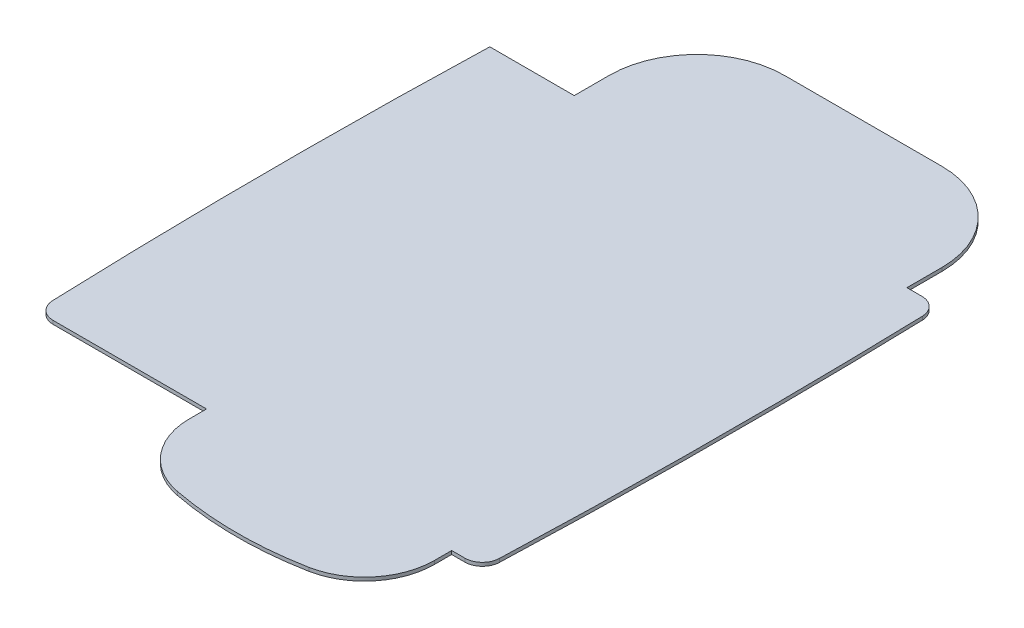
from build123d import *

# Parameters (mm, degrees)
EXTRUDE_1_DEPTH     = 0.5
SKETCH_3_W          = 25
SKETCH_3_H          = 35
CUT_EXTRUDE_1_DEPTH = 114.058613257
SKETCH_4_W          = 10
SKETCH_4_H          = 35
CUT_EXTRUDE_2_DEPTH = 114.058613257
SKETCH_5_W          = 50
SKETCH_5_H          = 20
CUT_EXTRUDE_3_DEPTH = 114.058613257
SKETCH_6_W          = 10
SKETCH_6_H          = 20
CUT_EXTRUDE_4_DEPTH = 114.058613257
EXTRUDE_2_DEPTH     = 0.5
CUT_EXTRUDE_5_DEPTH = 119.289418767
FILLET_1_R          = 5
FILLET_2_R          = 20


with BuildPart() as part:
    # ｽｹｯﾁ1 → ﾎﾞｽ - 押し出し1 (new, symmetric)
    with BuildSketch(Plane(origin=(0, 0, 0), x_dir=(1, 0, 0), z_dir=(0, 1, 0))):
        with BuildLine():
            Line((62.68888804, 92.5), (-62.68888804, 92.5))
            add(Edge.make_bspline(
                [(-62.68888804, 92.5), (-67.396314277, 0), (-62.68888804, -92.5)],
                knots=[4.444925752, 4.444925752, 4.444925752, 4.979852209, 4.979852209, 4.979852209], degree=2, weights=[1, 0.964444431, 1]))
            Line((-62.68888804, -92.5), (62.68888804, -92.5))
            add(Edge.make_bspline(
                [(62.68888804, -92.5), (67.396314277, 0), (62.68888804, 92.5)],
                knots=[1.303333099, 1.303333099, 1.303333099, 1.838259555, 1.838259555, 1.838259555], degree=2, weights=[1, 0.964444431, 1]))
        make_face()
    extrude(amount=EXTRUDE_1_DEPTH, both=True)

    # ｽｹｯﾁ3 → ｶｯﾄ - 押し出し1 (cut, through all)
    with BuildSketch(Plane(origin=(0, 0.5, 0), x_dir=(1, 0, 0), z_dir=(0, 1, 0))):
        with Locations((-52.5, 75)):
            Rectangle(SKETCH_3_W, SKETCH_3_H)
    extrude(amount=-CUT_EXTRUDE_1_DEPTH, mode=Mode.SUBTRACT)

    # ｽｹｯﾁ4 → ｶｯﾄ - 押し出し2 (cut, through all)
    with BuildSketch(Plane(origin=(0, 0.5, 0), x_dir=(1, 0, 0), z_dir=(0, 1, 0))):
        with Locations((60, 75)):
            Rectangle(SKETCH_4_W, SKETCH_4_H)
    extrude(amount=-CUT_EXTRUDE_2_DEPTH, mode=Mode.SUBTRACT)

    # ｽｹｯﾁ5 → ｶｯﾄ - 押し出し3 (cut, through all)
    with BuildSketch(Plane(origin=(0, 0.5, 0), x_dir=(1, 0, 0), z_dir=(0, 1, 0))):
        with Locations((-40, -82.5)):
            Rectangle(SKETCH_5_W, SKETCH_5_H)
    extrude(amount=-CUT_EXTRUDE_3_DEPTH, mode=Mode.SUBTRACT)

    # ｽｹｯﾁ6 → ｶｯﾄ - 押し出し4 (cut, through all)
    with BuildSketch(Plane(origin=(0, 0.5, 0), x_dir=(1, 0, 0), z_dir=(0, 1, 0))):
        with Locations((60, -82.5)):
            Rectangle(SKETCH_6_W, SKETCH_6_H)
    extrude(amount=-CUT_EXTRUDE_4_DEPTH, mode=Mode.SUBTRACT)

    # ｽｹｯﾁ7 → ﾎﾞｽ - 押し出し2 (add, symmetric)
    with BuildSketch(Plane(origin=(0, 0, 0), x_dir=(1, 0, 0), z_dir=(0, 1, 0))):
        with BuildLine():
            Line((-15, -92.5), (55, -92.5))
            ThreePointArc((55, -92.5), (20, -98.825030024), (-15, -92.5))
        make_face()
    extrude(amount=EXTRUDE_2_DEPTH, both=True)

    # ｽｹｯﾁ8 → ｶｯﾄ - 押し出し5 (cut, through all)
    with BuildSketch(Plane(origin=(0, 0.5, 0), x_dir=(1, 0, 0), z_dir=(0, 1, 0))):
        with BuildLine():
            ThreePointArc((-40, 67.5), (-32.677669545, 85.177669514), (-15.000000044, 92.5))
            Line((-15.000000044, 92.5), (-40, 92.5))
            Line((-40, 92.5), (-40, 67.5))
        make_face()
        with BuildLine():
            Line((55, 67.5), (55, 92.5))
            Line((55, 92.5), (30, 92.5))
            ThreePointArc((30, 92.5), (47.67766953, 85.17766953), (55, 67.5))
        make_face()
    extrude(amount=-CUT_EXTRUDE_5_DEPTH, mode=Mode.SUBTRACT)

    # ﾌｨﾚｯﾄ1
    fillet_1_edges = [part.edges().sort_by_distance(p)[0] for p in [
        (-63.590195865, -0.25, 72.5),
        (63.590195865, -0.2499997, 72.5),
        (64.116831739, -0.25, -57.5),
    ]]
    fillet(fillet_1_edges, radius=FILLET_1_R)

    # ﾌｨﾚｯﾄ2
    fillet_2_edges = [part.edges().sort_by_distance(p)[0] for p in [
        (-15, 0, 92.5),
        (55, 0, 92.5),
    ]]
    fillet(fillet_2_edges, radius=FILLET_2_R)


solid = part.part
